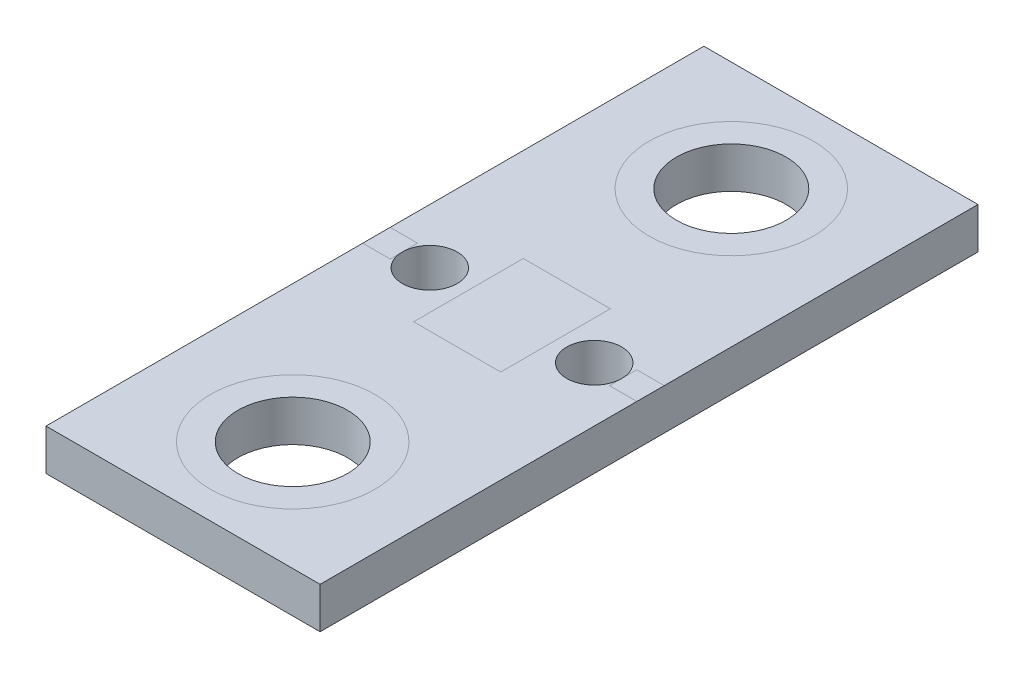
from build123d import *

# Parameters (mm, degrees)
SKETCH1_W           = 5
SKETCH1_H           = 12
SKETCH1_R           = 0.5
SKETCH1_R_2         = 1
BOSS_EXTRUDE1_DEPTH = 0.75


with BuildPart() as part:
    # Sketch1 → Boss-Extrude1 (new body)
    with BuildSketch(Plane(origin=(0, 0, 0), x_dir=(1, 0, 0), z_dir=(0, 1, 0))):
        Rectangle(SKETCH1_W, SKETCH1_H)
        with Locations(Location((-1.5, 0, 0), (0, 0, 270))):
            Circle(SKETCH1_R, mode=Mode.SUBTRACT)
        with Locations(Location((1.5, 0, 0), (0, 0, 270))):
            Circle(SKETCH1_R, mode=Mode.SUBTRACT)
        with Locations(Location((0, -4, 0), (0, 0, 270))):
            Circle(SKETCH1_R_2, mode=Mode.SUBTRACT)
        with Locations(Location((0, 4, 0), (0, 0, 270))):
            Circle(SKETCH1_R_2, mode=Mode.SUBTRACT)
    extrude(amount=BOSS_EXTRUDE1_DEPTH)


solid = part.part
